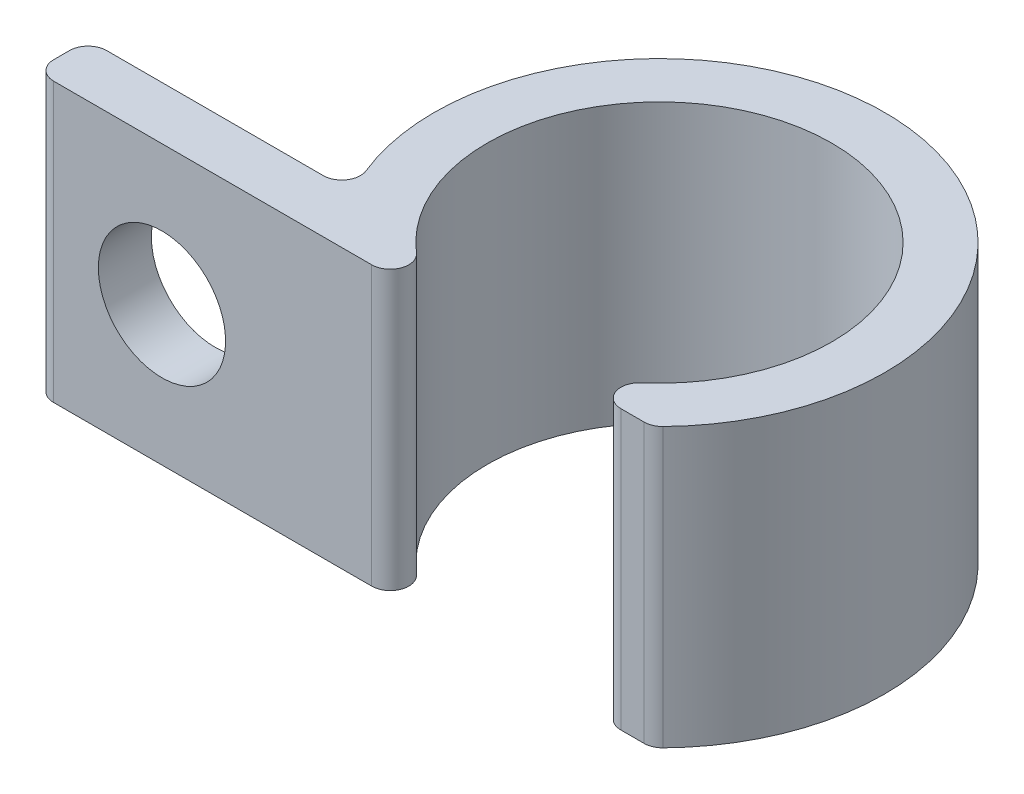
from build123d import *

# Parameters (mm, degrees)
BOSS_EXTRU_1_DEPTH = 10.5
D_GAGEMENT_M41_D   = 4.8


with BuildPart() as part:
    # Esquisse1 → Boss.-Extru.1 (new body)
    with BuildSketch(Plane(origin=(0, 0, 0), x_dir=(1, 0, 0), z_dir=(0, 1, 0))):
        with BuildLine():
            Line((0, 0), (12, 0))
            ThreePointArc((12, 0), (12.656200896, 0.45627806), (12.456944444, 1.230284617))
            ThreePointArc((12.456944444, 1.230284617), (16.7, 12.654356057), (20.943055556, 1.230284617))
            ThreePointArc((20.943055556, 1.230284617), (20.743799104, 0.45627806), (21.4, 0))
            Line((21.4, 0), (22.275840744, 0))
            ThreePointArc((22.275840744, 0), (22.54727633, 0.054769249), (22.776236708, 0.210506508))
            ThreePointArc((22.776236708, 0.210506508), (18.344835687, 14.493691496), (8.821918342, 2.962831439))
            ThreePointArc((8.821918342, 2.962831439), (8.753644409, 2.308836356), (8.173135147, 2))
            Line((8.173135147, 2), (0, 2))
            ThreePointArc((0, 2), (-0.494974747, 1.794974747), (-0.7, 1.3))
            Line((-0.7, 1.3), (-0.7, 0.7))
            ThreePointArc((-0.7, 0.7), (-0.494974747, 0.205025253), (0, 0))
        make_face()
    extrude(amount=BOSS_EXTRU_1_DEPTH)

    # Dégagement M41 (through all)
    with Locations(Plane(origin=(0, 0, -2), x_dir=(-1, 0, 0), z_dir=(0, 0, -1))):
        with Locations((-4.086567573, 5.25)):
            Hole(D_GAGEMENT_M41_D / 2)


solid = part.part
